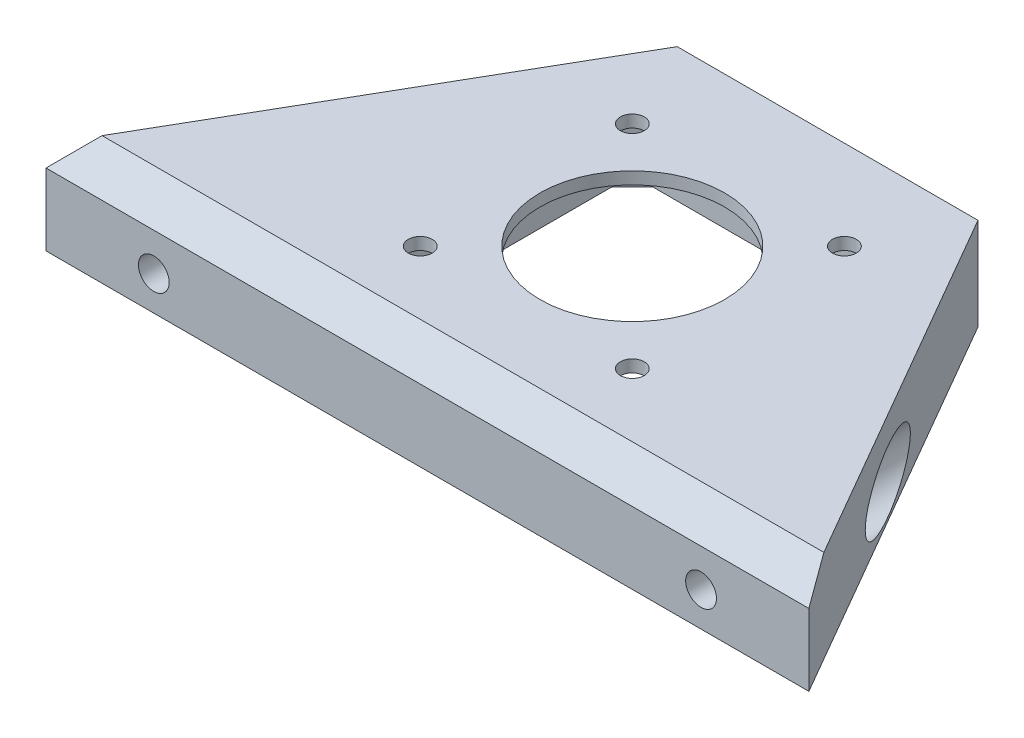
from build123d import *

# Parameters (mm, degrees)
BOSS_EXTRUDE1_DEPTH = 13.5
SKETCH2_W           = 45
SKETCH2_H           = 45
CUT_EXTRUDE1_DEPTH  = 11.72
SKETCH3_R           = 13.5
CUT_EXTRUDE2_DEPTH  = 84.329160712
CHAMFER1_SIZE       = 3
SKETCH7_W           = 113.25
SKETCH7_H           = 1.5
CUT_EXTRUDE4_DEPTH  = 84.598089841
CHAMFER2_SIZE       = 3
CHAMFER2_SIZE2      = 5.196152423
SKETCH8_R           = 2.25
CUT_EXTRUDE5_DEPTH  = 82.936336555
CUT_EXTRUDE6_START  = -4
SKETCH9_R           = 4.5
CUT_EXTRUDE6_DEPTH  = 78.936336555
SKETCH5_R           = 1.75
CUT_EXTRUDE7_DEPTH  = 84.013934059


with BuildPart() as part:
    # Sketch1 → Boss-Extrude1 (new body)
    with BuildSketch(Plane(origin=(0, 0, 0), x_dir=(1, 0, 0), z_dir=(0, 1, 0))):
        Polygon((-56.625, 0), (56.625, 0), (21.983983849, 60), (-21.983983849, 60), align=None)
    extrude(amount=BOSS_EXTRUDE1_DEPTH)

    # Sketch2 → Cut-Extrude1 (cut)
    with BuildSketch(Plane.XZ):
        with Locations((0, -31.45)):
            Rectangle(SKETCH2_W, SKETCH2_H)
    extrude(amount=-CUT_EXTRUDE1_DEPTH, mode=Mode.SUBTRACT)

    # Sketch3 → Cut-Extrude2 (cut, through all)
    with BuildSketch(Plane.XZ.offset(-11.72)):
        with Locations(Location((0, -31.45, 0), (0, 0, 270))):
            Circle(SKETCH3_R)
    extrude(amount=-CUT_EXTRUDE2_DEPTH, mode=Mode.SUBTRACT)

    # Chamfer1
    chamfer1_edges = [part.edges().sort_by_distance(p)[0] for p in [
        (-22.5, 5.86, -8.95),
        (-22.5, 5.86, -53.95),
        (22.5, 5.86, -53.95),
        (22.5, 5.86, -8.95),
    ]]
    chamfer(chamfer1_edges, length=CHAMFER1_SIZE)

    # Sketch7 → Cut-Extrude4 (cut, through all)
    with BuildSketch(Plane(origin=(0, 13.5, 0), x_dir=(1, 0, 0), z_dir=(0, 1, 0))):
        with Locations((0, 0.75)):
            Rectangle(SKETCH7_W, SKETCH7_H)
    extrude(amount=-CUT_EXTRUDE4_DEPTH, mode=Mode.SUBTRACT)

    # Chamfer2
    chamfer2_edges = [part.edges().sort_by_distance(p)[0] for p in [
        (0, 13.5, -1.5),
    ]]
    chamfer2_side = [part.faces().sort_by_distance(p)[0] for p in [
        (0, 6.75, -1.5),
    ]]
    chamfer(chamfer2_edges, length=CHAMFER2_SIZE, length2=CHAMFER2_SIZE2, reference=chamfer2_side[0])

    # Sketch8 → Cut-Extrude5 (cut, through all)
    with BuildSketch(Plane.XY.offset(-1.5)):
        with Locations((-40, 5)):
            Circle(SKETCH8_R)
        with Locations((40, 5)):
            Circle(SKETCH8_R)
    extrude(amount=-CUT_EXTRUDE5_DEPTH, mode=Mode.SUBTRACT)

    # Sketch9 → Cut-Extrude6 (cut, through all)
    with BuildSketch(Plane.XY.offset(-1.5).offset(CUT_EXTRUDE6_START)):
        with Locations((-40, 5)):
            Circle(SKETCH9_R)
        with Locations((40, 5)):
            Circle(SKETCH9_R)
    extrude(amount=-CUT_EXTRUDE6_DEPTH, mode=Mode.SUBTRACT)

    # Sketch5 → Cut-Extrude7 (cut, through all)
    with BuildSketch(Plane(origin=(0, 13.5, 0), x_dir=(1, 0, 0), z_dir=(0, 1, 0))):
        with Locations(Location((15.5, 46.95, 0), (0, 0, 270))):
            Circle(SKETCH5_R)
        with Locations(Location((15.5, 15.95, 0), (0, 0, 270))):
            Circle(SKETCH5_R)
        with Locations(Location((-15.5, 15.95, 0), (0, 0, 270))):
            Circle(SKETCH5_R)
        with Locations(Location((-15.5, 46.95, 0), (0, 0, 270))):
            Circle(SKETCH5_R)
    extrude(amount=-CUT_EXTRUDE7_DEPTH, mode=Mode.SUBTRACT)


solid = part.part
